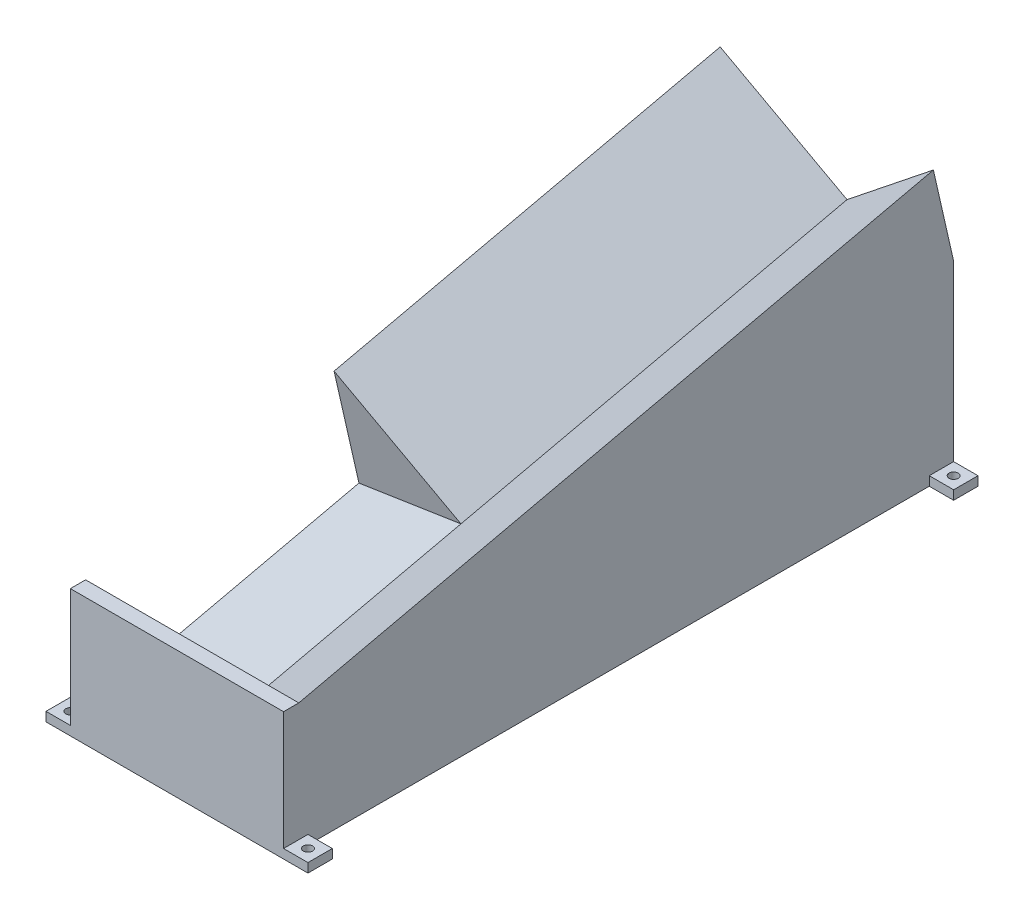
from build123d import *

# Parameters (mm, degrees)
SKETCH3_W           = 220
SKETCH3_H           = 10
BOSS_EXTRUDE2_DEPTH = 70
BOSS_EXTRUDE3_DEPTH = 130
BOSS_EXTRUDE4_DEPTH = 225
CUT_EXTRUDE1_START  = -227.161631
CUT_EXTRUDE1_DEPTH  = 97.161631
BOSS_EXTRUDE5_REACH = 249.52
SKETCH9_W           = 5
SKETCH9_H           = 41.901402289
SKETCH10_W          = 13.70856438
SKETCH10_H          = 41.94949396
CUT_EXTRUDE2_DEPTH  = 248.520249593
SKETCH11_W          = 8
SKETCH11_H          = 8
SKETCH11_R          = 1.5
BOSS_EXTRUDE6_DEPTH = 3


with BuildPart() as part:
    # Sketch3 → Boss-Extrude2 (new body)
    with BuildSketch(Plane(origin=(0, 0, 0), x_dir=(0, 0, -1), z_dir=(1, 0, 0))):
        Polygon((220, 10), (220, 60), (0, 10), align=None)
        with Locations((110, 5)):
            Rectangle(SKETCH3_W, SKETCH3_H)
    extrude(amount=BOSS_EXTRUDE2_DEPTH)

    # Sketch4 → Boss-Extrude3 (add)
    with BuildSketch(Plane(origin=(0, 50.491159136, -222.161100196), x_dir=(-1, 0, 0), z_dir=(0, 0.22162110358896814, -0.9751328557914598))):
        Polygon((-70, 39.751328558), (-70, 9.751328558), (-35, 9.751328558), align=None)
        Polygon((0, 39.751328558), (-35, 9.751328558), (0, 9.751328558), align=None)
    extrude(amount=-BOSS_EXTRUDE3_DEPTH)

    # Sketch4<3> → Boss-Extrude4 (add)
    with BuildSketch(Plane(origin=(0, 50.491159136, -222.161100196), x_dir=(-1, 0, 0), z_dir=(0, 0.22162110358896814, -0.9751328557914598))):
        Polygon((-70, 39.751328558), (-70, 9.751328558), (-35, 9.751328558), align=None)
    extrude(amount=-BOSS_EXTRUDE4_DEPTH)

    # Sketch8 → Cut-Extrude1 (cut)
    with BuildSketch(Plane(origin=(0, 50.491159136, -222.161100196), x_dir=(-1, 0, 0), z_dir=(0, 0.22162110358896814, -0.9751328557914598)).offset(CUT_EXTRUDE1_START)):
        Polygon((-35, 9.751328558), (0, 2.925398567), (0, 9.751328558), align=None)
    extrude(amount=CUT_EXTRUDE1_DEPTH, mode=Mode.SUBTRACT)

    # Boss-Extrude5: up to this face of the body (flat: up to its plane)
    boss_extrude5_end = Plane(part.part.faces().sort_by_distance((70, 34.124937216, -122.542284952))[0])
    # Sketch9 → Boss-Extrude5 (add, up to the picked face)
    with BuildSketch(Plane.ZY, mode=Mode.PRIVATE) as boss_extrude5_sk1:
        with Locations((-2.5, 20.950701145)):
            Rectangle(SKETCH9_W, SKETCH9_H)
    boss_extrude5_tool1 = split(extrude(boss_extrude5_sk1.sketch, amount=-BOSS_EXTRUDE5_REACH, mode=Mode.PRIVATE), bisect_by=boss_extrude5_end, keep=Keep.BOTH, mode=Mode.PRIVATE)
    add(boss_extrude5_tool1.solids().sort_by(Axis((0, 20.950701, -2.5), (1, 0, 0)))[0])

    # Sketch10 → Cut-Extrude2 (cut, through all)
    with BuildSketch(Plane.ZY):
        with Locations((6.85428219, 20.97474698)):
            Rectangle(SKETCH10_W, SKETCH10_H)
    extrude(amount=-CUT_EXTRUDE2_DEPTH, mode=Mode.SUBTRACT)

    # Sketch11 → Boss-Extrude6 (add)
    # profile 1 of 4: a face of its own
    with BuildSketch(Plane(origin=(0, 0, 0), x_dir=(1, 0, 0), z_dir=(0, 1, 0))):
        with Locations((-4, 216)):
            Rectangle(SKETCH11_W, SKETCH11_H)
        with Locations(Location((-4, 216, 0), (0, 0, 270))):
            Circle(SKETCH11_R, mode=Mode.SUBTRACT)
    # profile 2 of 4: a face of its own
    with BuildSketch(Plane(origin=(0, 0, 0), x_dir=(1, 0, 0), z_dir=(0, 1, 0))):
        with Locations((74, 216)):
            Rectangle(SKETCH11_W, SKETCH11_H)
        with Locations(Location((74, 216, 0), (0, 0, 270))):
            Circle(SKETCH11_R, mode=Mode.SUBTRACT)
    # profile 3 of 4: a face of its own
    with BuildSketch(Plane(origin=(0, 0, 0), x_dir=(1, 0, 0), z_dir=(0, 1, 0))):
        with Locations((-4, 4)):
            Rectangle(SKETCH11_W, SKETCH11_H)
        with Locations(Location((-4, 4, 0), (0, 0, 270))):
            Circle(SKETCH11_R, mode=Mode.SUBTRACT)
    # profile 4 of 4: a face of its own
    with BuildSketch(Plane(origin=(0, 0, 0), x_dir=(1, 0, 0), z_dir=(0, 1, 0))):
        with Locations((74, 4)):
            Rectangle(SKETCH11_W, SKETCH11_H)
        with Locations(Location((74, 4, 0), (0, 0, 270))):
            Circle(SKETCH11_R, mode=Mode.SUBTRACT)
    extrude(amount=BOSS_EXTRUDE6_DEPTH)


solid = part.part
